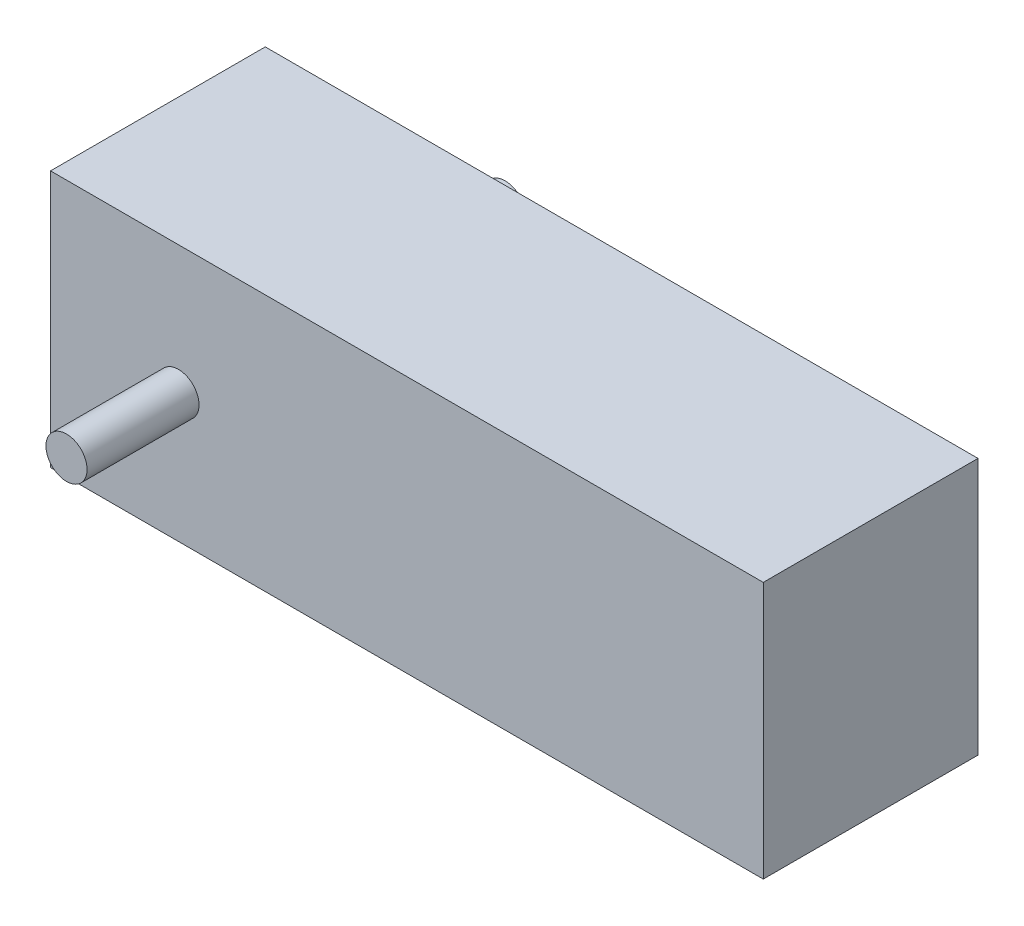
from build123d import *

# Parameters (mm, degrees)
SKETCH1_W           = 62.4
SKETCH1_H           = 22.5
BOSS_EXTRUDE1_DEPTH = 18.8
SKETCH2_R           = 1.8
BOSS_EXTRUDE2_DEPTH = 9.8
BOSS_EXTRUDE3_START = 9.8
SKETCH3_R           = 1.8
BOSS_EXTRUDE3_DEPTH = 9.8


with BuildPart() as part:
    # Sketch1 → Boss-Extrude1 (new body)
    with BuildSketch(Plane.XY):
        Rectangle(SKETCH1_W, SKETCH1_H)
    extrude(amount=BOSS_EXTRUDE1_DEPTH)

    # Sketch2 → Boss-Extrude2 (add)
    with BuildSketch(Plane.XY.offset(18.8)):
        with Locations((-20, 0)):
            Circle(SKETCH2_R)
    extrude(amount=BOSS_EXTRUDE2_DEPTH)

    # Sketch3 → Boss-Extrude3 (add)
    with BuildSketch(Plane(origin=(0, 0, 0), x_dir=(-1, 0, 0), z_dir=(0, 0, -1)).offset(BOSS_EXTRUDE3_START)):
        with Locations(Location((20, 0, 0), (0, 0, 180))):
            Circle(SKETCH3_R)
    extrude(amount=-BOSS_EXTRUDE3_DEPTH)


solid = part.part
